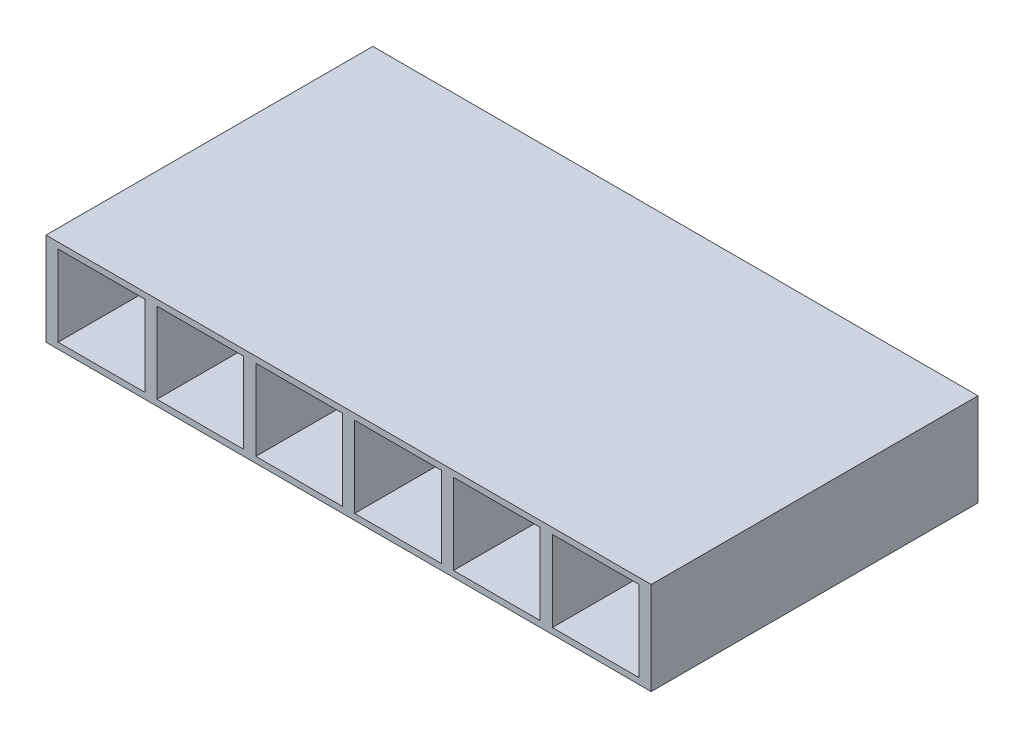
from build123d import *

# Parameters (mm, degrees)
ESQUISSE1_W        = 15
ESQUISSE1_H        = 2.3
ESQUISSE1_W_2      = 2.15
ESQUISSE1_H_2      = 2
BOSS_EXTRU_1_DEPTH = 8.1


with BuildPart() as part:
    # Esquisse1 → Boss.-Extru.1 (new body)
    with BuildSketch(Plane.XY):
        with Locations((-0.063064138, 0)):
            Rectangle(ESQUISSE1_W, ESQUISSE1_H)
        with Locations((-3.738064138, 0)):
            Rectangle(ESQUISSE1_W_2, ESQUISSE1_H_2, mode=Mode.SUBTRACT)
        with Locations((-6.188064138, 0)):
            Rectangle(ESQUISSE1_W_2, ESQUISSE1_H_2, mode=Mode.SUBTRACT)
        with Locations((-1.288064138, 0)):
            Rectangle(ESQUISSE1_W_2, ESQUISSE1_H_2, mode=Mode.SUBTRACT)
        with Locations((1.161935862, 0)):
            Rectangle(ESQUISSE1_W_2, ESQUISSE1_H_2, mode=Mode.SUBTRACT)
        with Locations((3.611935862, 0)):
            Rectangle(ESQUISSE1_W_2, ESQUISSE1_H_2, mode=Mode.SUBTRACT)
        with Locations((6.061935862, 0)):
            Rectangle(ESQUISSE1_W_2, ESQUISSE1_H_2, mode=Mode.SUBTRACT)
    extrude(amount=BOSS_EXTRU_1_DEPTH)


solid = part.part
